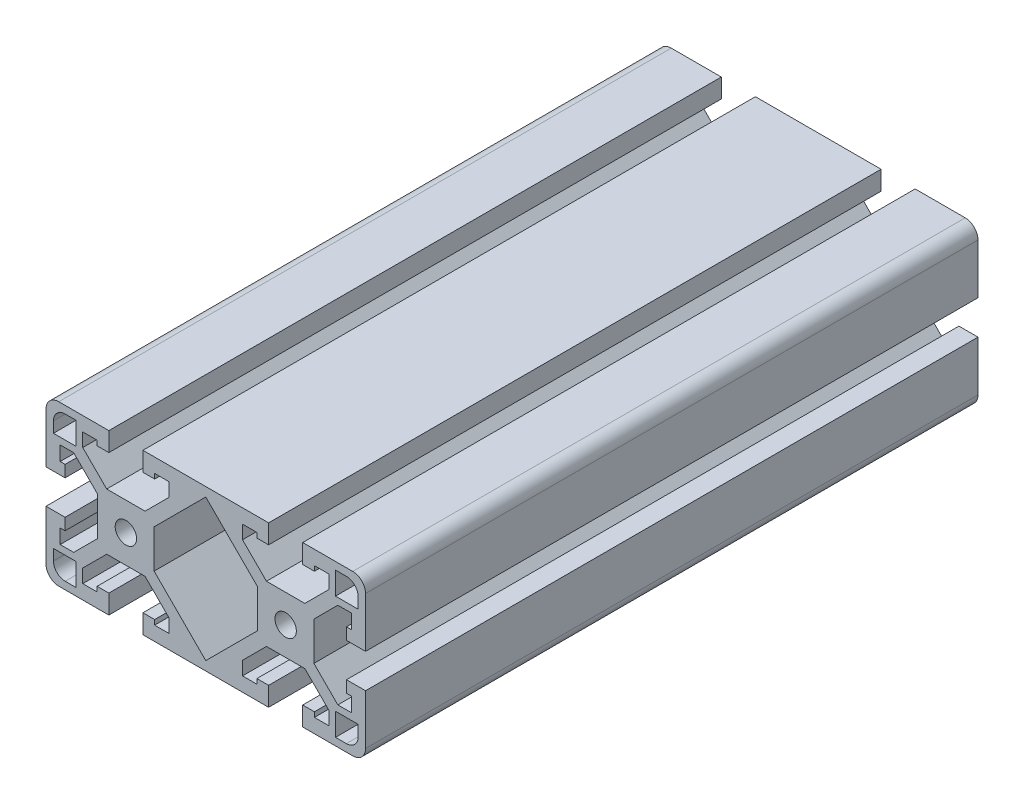
from build123d import *

# Parameters (mm, degrees)
SKETCH1_R           = 2.5527
BOSS_EXTRUDE1_DEPTH = 73.025


with BuildPart() as part:
    # Sketch1 → Boss-Extrude1 (new, symmetric)
    with BuildSketch(Plane.XY):
        with BuildLine():
            Line((-29.337, 12.442261469), (-29.337, 15.6718))
            Line((-29.337, 15.6718), (-25.908, 15.6718))
            Line((-25.908, 15.6718), (-25.908, 14.5034))
            Line((-25.908, 14.5034), (-23.114, 14.5034))
            Line((-23.114, 14.5034), (-23.114, 19.05))
            Line((-23.114, 19.05), (-35.052, 19.05))
            ThreePointArc((-35.052, 19.05), (-37.207261469, 18.157261469), (-38.1, 16.002))
            Line((-38.1, 16.002), (-38.1, 4.064))
            Line((-38.1, 4.064), (-33.5534, 4.064))
            Line((-33.5534, 4.064), (-33.5534, 6.858))
            Line((-33.5534, 6.858), (-34.7218, 6.858))
            Line((-34.7218, 6.858), (-34.7218, 10.287))
            Line((-34.7218, 10.287), (-31.492261469, 10.287))
            Line((-31.492261469, 10.287), (-25.781, 4.575738531))
            Line((-25.781, 4.575738531), (-25.781, -4.575738531))
            Line((-25.781, -4.575738531), (-31.492261469, -10.287))
            Line((-31.492261469, -10.287), (-34.7218, -10.287))
            Line((-34.7218, -10.287), (-34.7218, -6.858))
            Line((-34.7218, -6.858), (-33.5534, -6.858))
            Line((-33.5534, -6.858), (-33.5534, -4.064))
            Line((-33.5534, -4.064), (-38.1, -4.064))
            Line((-38.1, -4.064), (-38.1, -16.002))
            ThreePointArc((-38.1, -16.002), (-37.207261469, -18.157261469), (-35.052, -19.05))
            Line((-35.052, -19.05), (-23.114, -19.05))
            Line((-23.114, -19.05), (-23.114, -14.5034))
            Line((-23.114, -14.5034), (-25.908, -14.5034))
            Line((-25.908, -14.5034), (-25.908, -15.6718))
            Line((-25.908, -15.6718), (-29.337, -15.6718))
            Line((-29.337, -15.6718), (-29.337, -12.442261469))
            Line((-29.337, -12.442261469), (-23.625738531, -6.731))
            Line((-23.625738531, -6.731), (-14.474261469, -6.731))
            Line((-14.474261469, -6.731), (-8.763, -12.442261469))
            Line((-8.763, -12.442261469), (-8.763, -15.6718))
            Line((-8.763, -15.6718), (-12.192, -15.6718))
            Line((-12.192, -15.6718), (-12.192, -14.5034))
            Line((-12.192, -14.5034), (-14.986, -14.5034))
            Line((-14.986, -14.5034), (-14.986, -19.05))
            Line((-14.986, -19.05), (14.986, -19.05))
            Line((14.986, -19.05), (14.986, -14.5034))
            Line((14.986, -14.5034), (12.192, -14.5034))
            Line((12.192, -14.5034), (12.192, -15.6718))
            Line((12.192, -15.6718), (8.763, -15.6718))
            Line((8.763, -15.6718), (8.763, -12.442261469))
            Line((8.763, -12.442261469), (14.474261469, -6.731))
            Line((14.474261469, -6.731), (23.625738531, -6.731))
            Line((23.625738531, -6.731), (29.337, -12.442261469))
            Line((29.337, -12.442261469), (29.337, -15.6718))
            Line((29.337, -15.6718), (25.908, -15.6718))
            Line((25.908, -15.6718), (25.908, -14.5034))
            Line((25.908, -14.5034), (23.114, -14.5034))
            Line((23.114, -14.5034), (23.114, -19.05))
            Line((23.114, -19.05), (35.052, -19.05))
            ThreePointArc((35.052, -19.05), (37.207261469, -18.157261469), (38.1, -16.002))
            Line((38.1, -16.002), (38.1, -4.064))
            Line((38.1, -4.064), (33.5534, -4.064))
            Line((33.5534, -4.064), (33.5534, -6.858))
            Line((33.5534, -6.858), (34.7218, -6.858))
            Line((34.7218, -6.858), (34.7218, -10.287))
            Line((34.7218, -10.287), (31.492261469, -10.287))
            Line((31.492261469, -10.287), (25.781, -4.575738531))
            Line((25.781, -4.575738531), (25.781, 4.575738531))
            Line((25.781, 4.575738531), (31.492261469, 10.287))
            Line((31.492261469, 10.287), (34.7218, 10.287))
            Line((34.7218, 10.287), (34.7218, 6.858))
            Line((34.7218, 6.858), (33.5534, 6.858))
            Line((33.5534, 6.858), (33.5534, 4.064))
            Line((33.5534, 4.064), (38.1, 4.064))
            Line((38.1, 4.064), (38.1, 16.002))
            ThreePointArc((38.1, 16.002), (37.207261469, 18.157261469), (35.052, 19.05))
            Line((35.052, 19.05), (23.114, 19.05))
            Line((23.114, 19.05), (23.114, 14.5034))
            Line((23.114, 14.5034), (25.908, 14.5034))
            Line((25.908, 14.5034), (25.908, 15.6718))
            Line((25.908, 15.6718), (29.337, 15.6718))
            Line((29.337, 15.6718), (29.337, 12.442261469))
            Line((29.337, 12.442261469), (23.625738531, 6.731))
            Line((23.625738531, 6.731), (14.474261469, 6.731))
            Line((14.474261469, 6.731), (8.763, 12.442261469))
            Line((8.763, 12.442261469), (8.763, 15.6718))
            Line((8.763, 15.6718), (12.192, 15.6718))
            Line((12.192, 15.6718), (12.192, 14.5034))
            Line((12.192, 14.5034), (14.986, 14.5034))
            Line((14.986, 14.5034), (14.986, 19.05))
            Line((14.986, 19.05), (-14.986, 19.05))
            Line((-14.986, 19.05), (-14.986, 14.5034))
            Line((-14.986, 14.5034), (-12.192, 14.5034))
            Line((-12.192, 14.5034), (-12.192, 15.6718))
            Line((-12.192, 15.6718), (-8.763, 15.6718))
            Line((-8.763, 15.6718), (-8.763, 12.442261469))
            Line((-8.763, 12.442261469), (-14.474261469, 6.731))
            Line((-14.474261469, 6.731), (-23.625738531, 6.731))
            Line((-23.625738531, 6.731), (-29.337, 12.442261469))
        make_face()
        with Locations((-19.05, 0)):
            Circle(SKETCH1_R, mode=Mode.SUBTRACT)
        with Locations((19.05, 0)):
            Circle(SKETCH1_R, mode=Mode.SUBTRACT)
        Polygon((-12.319, 4.575738531), (-12.319, -4.575738531), (0, -16.894738531), (12.319, -4.575738531), (12.319, 4.575738531), (0, 16.894738531), align=None, mode=Mode.SUBTRACT)
        with BuildLine():
            Line((-30.9372, 11.8872), (-30.9372, 17.272))
            Line((-30.9372, 17.272), (-33.528, 17.272))
            ThreePointArc((-33.528, 17.272), (-35.503656347, 16.453656347), (-36.322, 14.478))
            Line((-36.322, 14.478), (-36.322, 11.8872))
            Line((-36.322, 11.8872), (-30.9372, 11.8872))
        make_face(mode=Mode.SUBTRACT)
        with BuildLine():
            Line((-30.9372, -17.272), (-30.9372, -11.8872))
            Line((-30.9372, -11.8872), (-36.322, -11.8872))
            Line((-36.322, -11.8872), (-36.322, -14.478))
            ThreePointArc((-36.322, -14.478), (-35.503656347, -16.453656347), (-33.528, -17.272))
            Line((-33.528, -17.272), (-30.9372, -17.272))
        make_face(mode=Mode.SUBTRACT)
        with BuildLine():
            Line((36.322, -11.8872), (30.9372, -11.8872))
            Line((30.9372, -11.8872), (30.9372, -17.272))
            Line((30.9372, -17.272), (33.528, -17.272))
            ThreePointArc((33.528, -17.272), (35.503656347, -16.453656347), (36.322, -14.478))
            Line((36.322, -14.478), (36.322, -11.8872))
        make_face(mode=Mode.SUBTRACT)
        with BuildLine():
            Line((30.9372, 17.272), (30.9372, 11.8872))
            Line((30.9372, 11.8872), (36.322, 11.8872))
            Line((36.322, 11.8872), (36.322, 14.478))
            ThreePointArc((36.322, 14.478), (35.503656347, 16.453656347), (33.528, 17.272))
            Line((33.528, 17.272), (30.9372, 17.272))
        make_face(mode=Mode.SUBTRACT)
    extrude(amount=BOSS_EXTRUDE1_DEPTH, both=True)


solid = part.part
